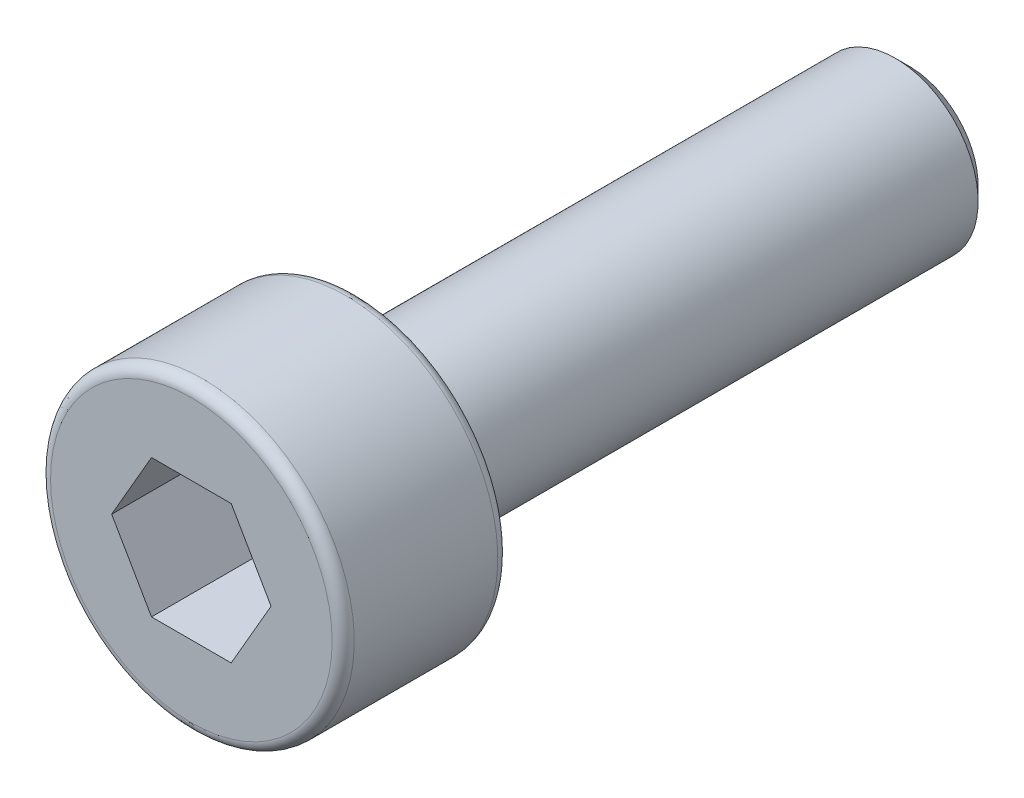
from build123d import *

# Parameters (mm, degrees)
SKETCH1_R           = 2.75
BOSS_EXTRUDE1_DEPTH = 3
SKETCH2_R           = 1.5
BOSS_EXTRUDE2_DEPTH = 10
CUT_EXTRUDE1_DEPTH  = 2
CHAMFER1_SIZE       = 0.25
FILLET1_R           = 0.2


with BuildPart() as part:
    # Sketch1 → Boss-Extrude1 (new body)
    with BuildSketch(Plane.XY.offset(13)):
        with Locations(Location((0, 0, 0), (0, 0, 180))):
            Circle(SKETCH1_R)
    extrude(amount=-BOSS_EXTRUDE1_DEPTH)

    # Sketch2 → Boss-Extrude2 (add)
    with BuildSketch(Plane(origin=(0, 0, 10), x_dir=(-1, 0, 0), z_dir=(0, 0, -1))):
        Circle(SKETCH2_R)
    extrude(amount=BOSS_EXTRUDE2_DEPTH)

    # Sketch3 → Cut-Extrude1 (cut)
    with BuildSketch(Plane.XY.offset(13)):
        Polygon((-1.443375673, 0), (-0.721687836, -1.25), (0.721687836, -1.25), (1.443375673, 0), (0.721687836, 1.25), (-0.721687836, 1.25), align=None)
    extrude(amount=-CUT_EXTRUDE1_DEPTH, mode=Mode.SUBTRACT)

    # Chamfer1
    chamfer1_edges = [part.edges().sort_by_distance(p)[0] for p in [
        (1.5, 0, 0),
    ]]
    chamfer(chamfer1_edges, length=CHAMFER1_SIZE)

    # Fillet1
    fillet1_edges = [part.edges().sort_by_distance(p)[0] for p in [
        (2.75, 0, 13),
        (2.75, 0, 10),
    ]]
    fillet(fillet1_edges, radius=FILLET1_R)


solid = part.part
